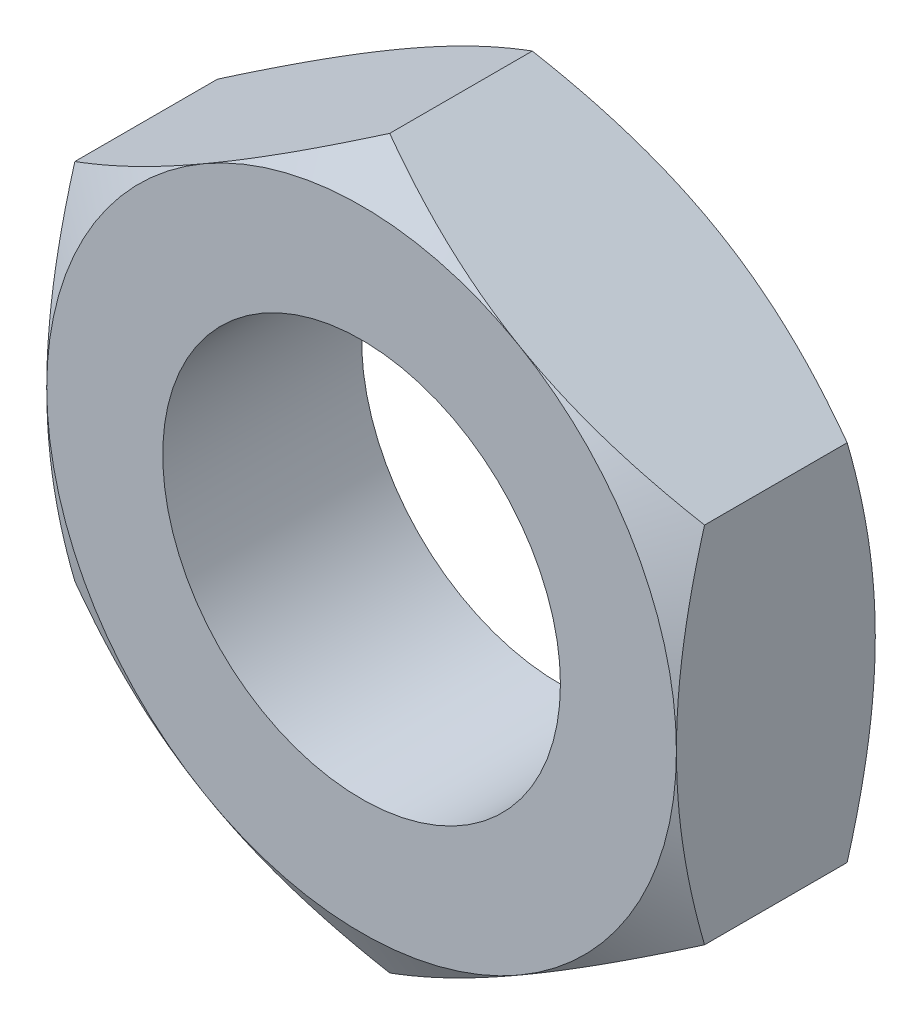
from build123d import *

# Parameters (mm, degrees)
SZKIC1_R                    = 6
DODANIE_WYCI_GNI_CIE1_DEPTH = 3
SZKIC2_OUTSIDE_W            = 47.712
SZKIC2_OUTSIDE_H            = 50.652
SZKIC2_OUTSIDE_R            = 9.5
WYTNIJ_WYCI_GNI_CIE2_DEPTH  = 6
WYTNIJ_WYCI_GNI_CIE2_DRAFT  = -60
LUSTRO1_COPY_1_SKETCH_W     = 47.712
LUSTRO1_COPY_1_SKETCH_H     = 50.652
LUSTRO1_COPY_1_SKETCH_R     = 9.5
LUSTRO1_COPY_1_DEPTH        = 6
LUSTRO1_COPY_1_DRAFT        = -60


with BuildPart() as part:
    # Szkic1 → Dodanie-wyciągnięcie1 (new, symmetric)
    with BuildSketch(Plane.XY):
        Polygon((-9.5, 5.484827557), (-9.5, -5.484827557), (0, -10.969655115), (9.5, -5.484827557), (9.5, 5.484827557), (0, 10.969655115), align=None)
        Circle(SZKIC1_R, mode=Mode.SUBTRACT)
    extrude(amount=DODANIE_WYCI_GNI_CIE1_DEPTH, both=True)


with BuildPart() as wytnij_wyci_gni_cie2_tool:
    # Szkic2 outside → Wytnij-wyciągnięcie2 (with draft: the straight prism first)
    with BuildSketch(Plane.XY.offset(3)):
        Rectangle(SZKIC2_OUTSIDE_W, SZKIC2_OUTSIDE_H)
        Circle(SZKIC2_OUTSIDE_R, mode=Mode.SUBTRACT)
    extrude(amount=-WYTNIJ_WYCI_GNI_CIE2_DEPTH)
    # Wytnij-wyciągnięcie2: the draft: its side faces are tilted about the plane it starts from
    wytnij_wyci_gni_cie2_sides = [wytnij_wyci_gni_cie2_tool.faces().sort_by_distance(p)[0] for p in [
        (0, -25.326, 0),
        (23.856, 0, 0),
        (0, 25.326, 0),
        (-23.856, 0, 0),
        (-9.5, 0, 0),
    ]]
    draft(wytnij_wyci_gni_cie2_sides, Plane.XY.offset(3), WYTNIJ_WYCI_GNI_CIE2_DRAFT)


with BuildPart() as part_1:
    add(part.part)

    # Wytnij-wyciągnięcie2: cut by wytnij_wyci_gni_cie2_tool
    add(wytnij_wyci_gni_cie2_tool.part, mode=Mode.SUBTRACT)


with BuildPart() as lustro1_copy_1_tool:
    # Lustro1 copy 1 sketch → Lustro1 copy 1 (with draft: the straight prism first)
    with BuildSketch(Plane(origin=(0, 0, -3), x_dir=(1, 0, 0), z_dir=(0, 0, -1))):
        Rectangle(LUSTRO1_COPY_1_SKETCH_W, LUSTRO1_COPY_1_SKETCH_H)
        Circle(LUSTRO1_COPY_1_SKETCH_R, mode=Mode.SUBTRACT)
    extrude(amount=-LUSTRO1_COPY_1_DEPTH)
    # Lustro1 copy 1: the draft: its side faces are tilted about the plane it starts from
    lustro1_copy_1_sides = [lustro1_copy_1_tool.faces().sort_by_distance(p)[0] for p in [
        (0, -25.326, 0),
        (23.856, 0, 0),
        (0, 25.326, 0),
        (-23.856, 0, 0),
        (-9.5, 0, 0),
    ]]
    draft(lustro1_copy_1_sides, Plane(origin=(0, 0, -3), x_dir=(1, 0, 0), z_dir=(0, 0, -1)), LUSTRO1_COPY_1_DRAFT)


with BuildPart() as part_2:
    add(part_1.part)

    # Lustro1 copy 1: cut by lustro1_copy_1_tool
    add(lustro1_copy_1_tool.part, mode=Mode.SUBTRACT)


solid = part_2.part
